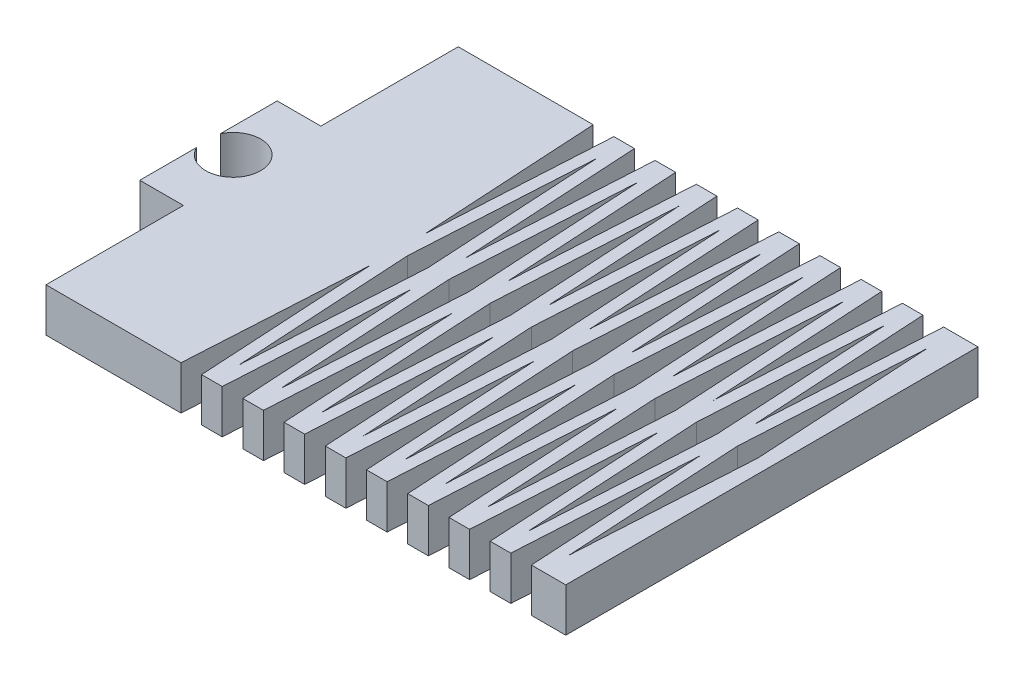
from build123d import *

# Parameters (mm, degrees)
BOSS_EXTRUDE1_DEPTH = 3.175


with BuildPart() as part:
    # Sketch1 → Boss-Extrude1 (new body)
    with BuildSketch(Plane(origin=(0, 0, 0), x_dir=(1, 0, 0), z_dir=(0, 1, 0))):
        with BuildLine():
            Line((13, 0), (3.175, 0))
            Line((3.175, 0), (3.175, -10))
            Line((3.175, -10), (0, -10))
            Line((0, -10), (0, -14.128220211))
            ThreePointArc((0, -14.128220211), (3.8, -15), (0, -15.871779789))
            Line((0, -15.871779789), (0, -20))
            Line((0, -20), (3.175, -20))
            Line((3.175, -20), (3.175, -30))
            Line((3.175, -30), (13, -30))
            Line((13, -30), (13.75, -17))
            Line((13.75, -17), (14.5, -30))
            Line((14.5, -30), (16, -30))
            Line((16, -30), (16.75, -17))
            Line((16.75, -17), (17.5, -30))
            Line((17.5, -30), (19, -30))
            Line((19, -30), (19.75, -17))
            Line((19.75, -17), (20.5, -30))
            Line((20.5, -30), (22, -30))
            Line((22, -30), (22.75, -17))
            Line((22.75, -17), (23.5, -30))
            Line((23.5, -30), (25, -30))
            Line((25, -30), (25.75, -17))
            Line((25.75, -17), (26.5, -30))
            Line((26.5, -30), (28, -30))
            Line((28, -30), (28.75, -17))
            Line((28.75, -17), (29.5, -30))
            Line((29.5, -30), (31, -30))
            Line((31, -30), (31.75, -17))
            Line((31.75, -17), (32.5, -30))
            Line((32.5, -30), (34, -30))
            Line((34, -30), (34.75, -17))
            Line((34.75, -17), (35.5, -30))
            Line((35.5, -30), (37, -30))
            Line((37, -30), (37.75, -17))
            Line((37.75, -17), (38.5, -30))
            Line((38.5, -30), (40, -30))
            Line((40, -30), (41, -30))
            Line((41, -30), (41, 0))
            Line((41, 0), (40, 0))
            Line((40, 0), (38.5, 0))
            Line((38.5, 0), (37.75, -13))
            Line((37.75, -13), (37, 0))
            Line((37, 0), (35.5, 0))
            Line((35.5, 0), (34.75, -13))
            Line((34.75, -13), (34, 0))
            Line((34, 0), (32.5, 0))
            Line((32.5, 0), (31.75, -13))
            Line((31.75, -13), (31, 0))
            Line((31, 0), (29.5, 0))
            Line((29.5, 0), (28.75, -13))
            Line((28.75, -13), (28, 0))
            Line((28, 0), (26.5, 0))
            Line((26.5, 0), (25.75, -13))
            Line((25.75, -13), (25, 0))
            Line((25, 0), (23.5, 0))
            Line((23.5, 0), (22.75, -13))
            Line((22.75, -13), (22, 0))
            Line((22, 0), (20.5, 0))
            Line((20.5, 0), (19.75, -13))
            Line((19.75, -13), (19, 0))
            Line((19, 0), (17.5, 0))
            Line((17.5, 0), (16.75, -13))
            Line((16.75, -13), (16, 0))
            Line((16, 0), (14.5, 0))
            Line((14.5, 0), (13.75, -13))
            Line((13.75, -13), (13, 0))
        make_face()
        Polygon((14.5, -15), (15.25, -2), (16, -15), (15.25, -28), align=None, mode=Mode.SUBTRACT)
        Polygon((17.5, -15), (18.25, -2), (19, -15), (18.25, -28), align=None, mode=Mode.SUBTRACT)
        Polygon((20.5, -15), (21.25, -2), (22, -15), (21.25, -28), align=None, mode=Mode.SUBTRACT)
        Polygon((23.5, -15), (24.25, -2), (25, -15), (24.25, -28), align=None, mode=Mode.SUBTRACT)
        Polygon((26.5, -15), (27.25, -2), (28, -15), (27.25, -28), align=None, mode=Mode.SUBTRACT)
        Polygon((29.5, -15), (30.25, -2), (31, -15), (30.25, -28), align=None, mode=Mode.SUBTRACT)
        Polygon((32.5, -15), (33.25, -2), (34, -15), (33.25, -28), align=None, mode=Mode.SUBTRACT)
        Polygon((35.5, -15), (36.25, -2), (37, -15), (36.25, -28), align=None, mode=Mode.SUBTRACT)
        Polygon((38.5, -15), (39.25, -2), (40, -15), (39.25, -28), align=None, mode=Mode.SUBTRACT)
    extrude(amount=BOSS_EXTRUDE1_DEPTH)


solid = part.part
